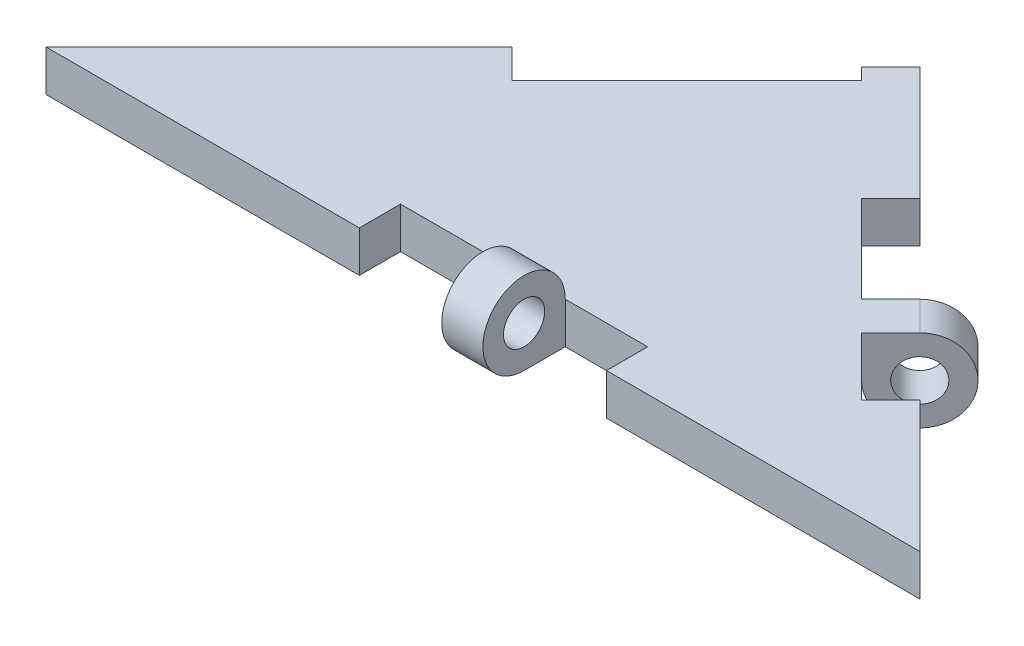
from build123d import *

# Parameters (mm, degrees)
BOSS_EXTRUDE1_DEPTH = 5
SKETCH2_W           = 30
SKETCH2_H           = 5
CUT_EXTRUDE1_DEPTH  = 5
CUT_EXTRUDE2_DEPTH  = 5
BOSS_EXTRUDE2_START = 10
BOSS_EXTRUDE2_DEPTH = 5
BOSS_EXTRUDE3_START = 10
BOSS_EXTRUDE3_DEPTH = 5
CUT_EXTRUDE3_DEPTH  = 10


with BuildPart() as part:
    # Sketch1 → Boss-Extrude1 (new body)
    with BuildSketch(Plane(origin=(0, 0, 0), x_dir=(1, 0, 0), z_dir=(0, 1, 0))):
        Polygon((-53.033008589, 0), (53.033008589, 0), (0, 53.033008589), align=None)
    extrude(amount=BOSS_EXTRUDE1_DEPTH)

    # Sketch2 → Cut-Extrude1 (cut)
    with BuildSketch(Plane(origin=(0, 5, 0), x_dir=(1, 0, 0), z_dir=(0, 1, 0))):
        with Locations((0, 2.5)):
            Rectangle(SKETCH2_W, SKETCH2_H)
        Polygon((-3.535533906, 49.497474683), (-24.748737342, 28.284271247), (-21.213203436, 24.748737342), (0, 45.961940777), align=None)
    extrude(amount=-CUT_EXTRUDE1_DEPTH, mode=Mode.SUBTRACT)

    # Sketch3 → Cut-Extrude2 (cut)
    with BuildSketch(Plane.XZ):
        Polygon((15.909902577, -37.123106012), (37.123106012, -15.909902577), (33.587572106, -12.374368671), (12.374368671, -33.587572106), align=None)
    extrude(amount=-CUT_EXTRUDE2_DEPTH, mode=Mode.SUBTRACT)

    # Sketch5 → Boss-Extrude2 (add)
    with BuildSketch(Plane.ZY.offset(-15).offset(BOSS_EXTRUDE2_START)):
        with BuildLine():
            Line((-2.5, 5), (-5, 5))
            ThreePointArc((-5, 5), (-3.535533906, 1.464466094), (0, 0))
            Line((0, 0), (0, 2.5))
            ThreePointArc((0, 2.5), (-1.767766953, 3.232233047), (-2.5, 5))
        make_face()
        with BuildLine():
            ThreePointArc((0, 0), (3.535533906, 1.464466094), (5, 5))
            ThreePointArc((5, 5), (0, 10), (-5, 5))
            Line((-5, 5), (-2.5, 5))
            ThreePointArc((-2.5, 5), (0, 7.5), (2.5, 5))
            ThreePointArc((2.5, 5), (1.767766953, 3.232233047), (0, 2.5))
            Line((0, 2.5), (0, 0))
        make_face()
        with BuildLine():
            ThreePointArc((0, 0), (-3.535533906, 1.464466094), (-5, 5))
            Line((-5, 5), (-5, 0))
            Line((-5, 0), (0, 0))
        make_face()
    extrude(amount=BOSS_EXTRUDE2_DEPTH)

    # Sketch6 → Boss-Extrude3 (add)
    with BuildSketch(Plane(origin=(10.606601718, 0, 10.606601718), x_dir=(-0.7071067811865478, 0, 0.7071067811865472), z_dir=(-0.7071067811865472, 0, -0.7071067811865478)).offset(BOSS_EXTRUDE3_START)):
        with BuildLine():
            ThreePointArc((-37.5, 5), (-41.035533906, -3.535533906), (-32.5, 0))
            Line((-32.5, 0), (-35, 0))
            ThreePointArc((-35, 0), (-39.267766953, -1.767766953), (-37.5, 2.5))
            Line((-37.5, 2.5), (-37.5, 5))
        make_face()
        with BuildLine():
            Line((-35, 0), (-32.5, 0))
            ThreePointArc((-32.5, 0), (-33.964466094, 3.535533906), (-37.5, 5))
            Line((-37.5, 5), (-37.5, 2.5))
            ThreePointArc((-37.5, 2.5), (-35.732233047, 1.767766953), (-35, 0))
        make_face()
        with BuildLine():
            ThreePointArc((-37.5, 5), (-33.964466094, 3.535533906), (-32.5, 0))
            Line((-32.5, 0), (-32.5, 5))
            Line((-32.5, 5), (-37.5, 5))
        make_face()
    extrude(amount=BOSS_EXTRUDE3_DEPTH)

    # Sketch7 → Cut-Extrude3 (cut)
    with BuildSketch(Plane.XZ):
        Polygon((0, -53.033008589), (-23.41088221, -29.622126379), (-21.289561866, -27.500806036), (2.121320344, -50.911688245), align=None)
    extrude(amount=-CUT_EXTRUDE3_DEPTH, mode=Mode.SUBTRACT)


solid = part.part
